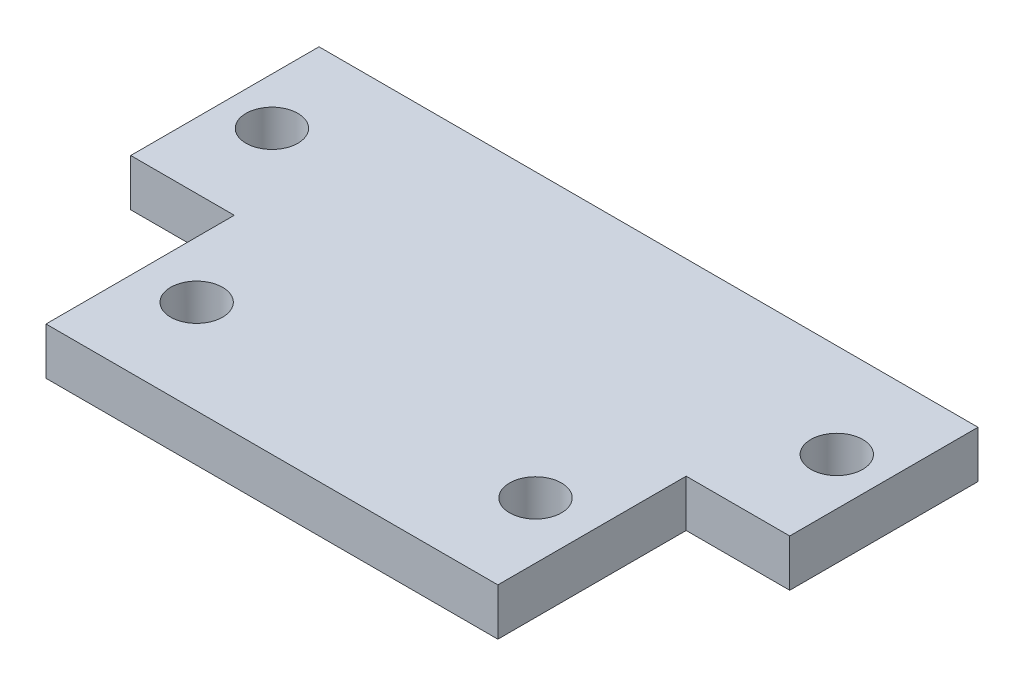
from build123d import *

# Parameters (mm, degrees)
SKETCH1_W           = 44.45
SKETCH1_H           = 12.7
SKETCH1_R           = 1.75
SKETCH1_W_2         = 30.48
BOSS_EXTRUDE1_DEPTH = 3.175
SKETCH2_R           = 1.75
CUT_EXTRUDE1_DEPTH  = 12.192


with BuildPart() as part:
    # Sketch1 → Boss-Extrude1 (new body)
    # profile 1 of 2: a face of its own
    with BuildSketch(Plane(origin=(0, 0, 0), x_dir=(-1, 0, 0), z_dir=(0, 1, 0))):
        Rectangle(SKETCH1_W, SKETCH1_H)
        with Locations(Location((19.05, 0, 0), (0, 0, 90))):
            Circle(SKETCH1_R, mode=Mode.SUBTRACT)
        with Locations(Location((-19.05, 0, 0), (0, 0, 90))):
            Circle(SKETCH1_R, mode=Mode.SUBTRACT)
    # profile 2 of 2: a face of its own
    with BuildSketch(Plane(origin=(0, 0, 0), x_dir=(-1, 0, 0), z_dir=(0, 1, 0))):
        with Locations((0, 12.7)):
            Rectangle(SKETCH1_W_2, SKETCH1_H)
    extrude(amount=BOSS_EXTRUDE1_DEPTH)

    # Sketch2 → Cut-Extrude1 (cut)
    with BuildSketch(Plane(origin=(0, 3.175, 0), x_dir=(-1, 0, 0), z_dir=(0, 1, 0))):
        with Locations(Location((-11.43, 12.7, 0), (0, 0, 90))):
            Circle(SKETCH2_R)
        with Locations(Location((11.43, 12.7, 0), (0, 0, 90))):
            Circle(SKETCH2_R)
    extrude(amount=-CUT_EXTRUDE1_DEPTH, mode=Mode.SUBTRACT)


solid = part.part
